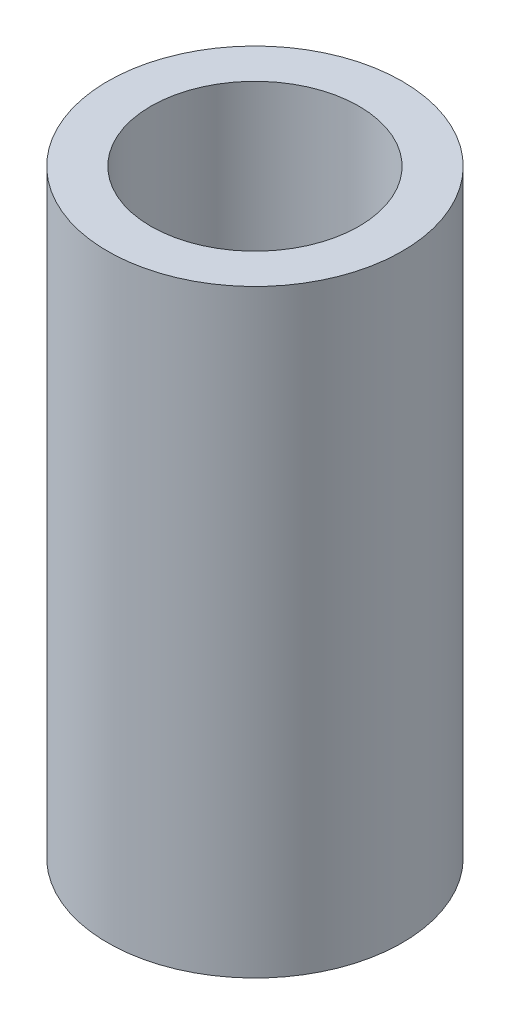
from build123d import *

# Parameters (mm, degrees)
SKETCH1_R           = 7.5
BOSS_EXTRUDE1_DEPTH = 30.5
SKETCH2_R           = 5.3
CUT_EXTRUDE1_DEPTH  = 33.291639785


with BuildPart() as part:
    # Sketch1 → Boss-Extrude1 (new body)
    with BuildSketch(Plane(origin=(0, 0, 0), x_dir=(1, 0, 0), z_dir=(0, 1, 0))):
        with Locations(Location((0, 0, 0), (0, 0, 90))):
            Circle(SKETCH1_R)
    extrude(amount=BOSS_EXTRUDE1_DEPTH)

    # Sketch2 → Cut-Extrude1 (cut, through all)
    with BuildSketch(Plane(origin=(0, 30.5, 0), x_dir=(1, 0, 0), z_dir=(0, 1, 0))):
        with Locations(Location((0, 0, 0), (0, 0, 270))):
            Circle(SKETCH2_R)
    extrude(amount=-CUT_EXTRUDE1_DEPTH, mode=Mode.SUBTRACT)


solid = part.part
